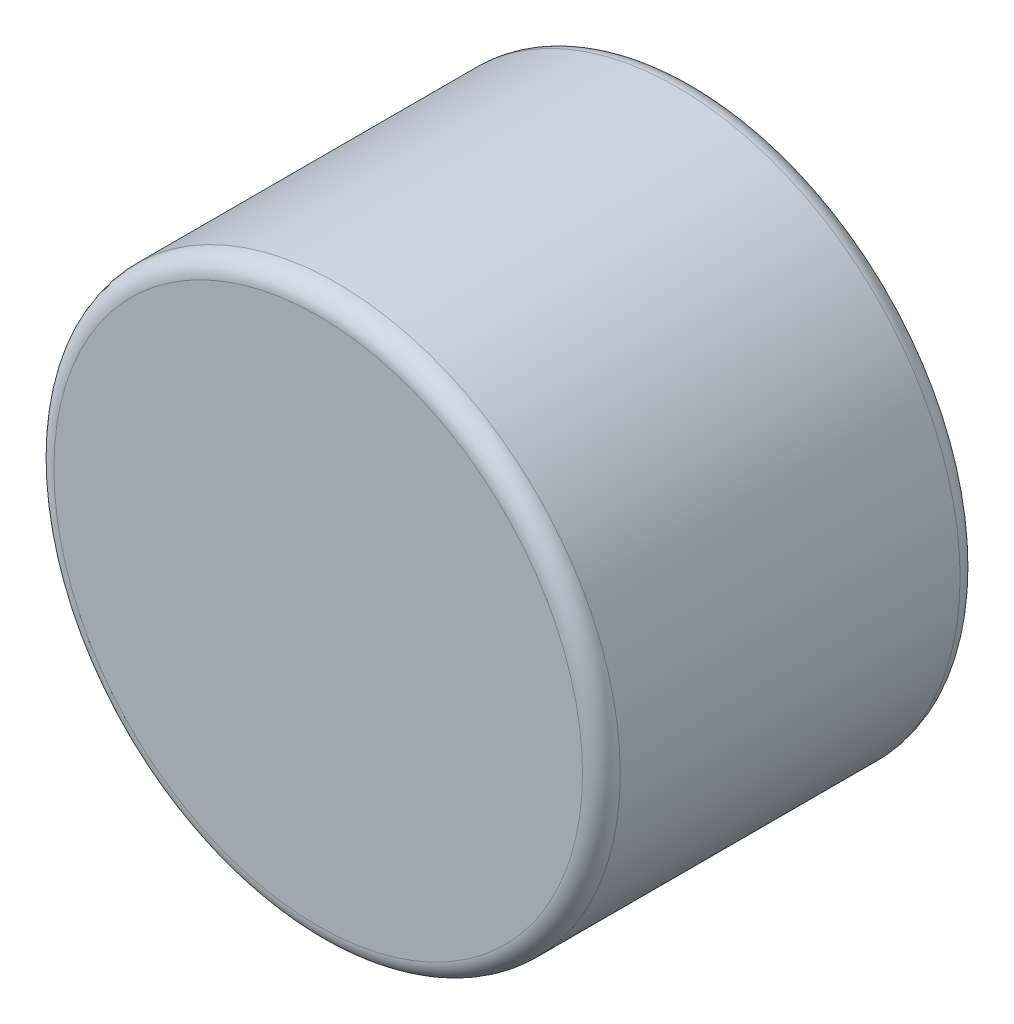
from build123d import *

# Parameters (mm, degrees)
SKETCH1_R           = 38.1
BOSS_EXTRUDE1_DEPTH = 50.8
FILLET1_R           = 2.54


with BuildPart() as part:
    # Sketch1 → Boss-Extrude1 (new body)
    with BuildSketch(Plane.XY):
        Circle(SKETCH1_R)
    extrude(amount=BOSS_EXTRUDE1_DEPTH)

    # Fillet1
    fillet1_edges = [part.edges().sort_by_distance(p)[0] for p in [
        (-38.1, 0, 0),
        (-38.1, 0, 50.8),
    ]]
    fillet(fillet1_edges, radius=FILLET1_R)


solid = part.part
